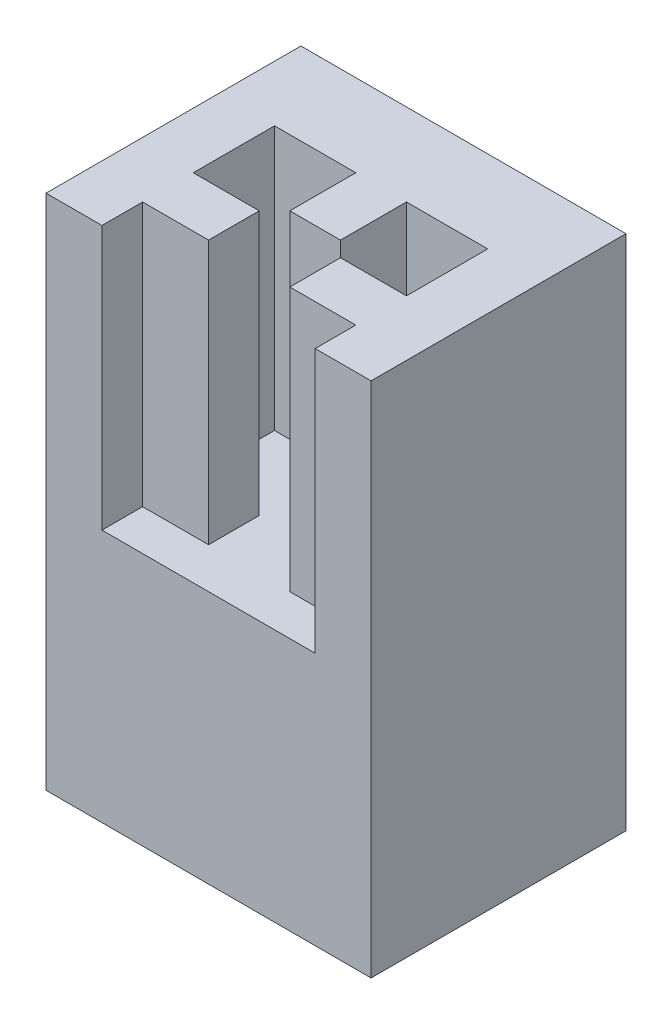
from build123d import *

# Parameters (mm, degrees)
ESQUISSE1_W                  = 30.8
ESQUISSE1_H                  = 24.15
BOSS_EXTRU_1_DEPTH           = 49
ESQUISSE3_R                  = 2.75
ENL_V_MAT_EXTRU_3_DEPTH      = 22
ENL_V_MAT_EXTRU_4_DEPTH      = 67.174451426
ENL_V_MAT_EXTRU_4_DEPTH_BACK = 25


with BuildPart() as part:
    # Esquisse1 → Boss.-Extru.1 (new body)
    with BuildSketch(Plane(origin=(0, 0, 0), x_dir=(1, 0, 0), z_dir=(0, 1, 0))):
        with Locations((-24.160479042, -8.248053892)):
            Rectangle(ESQUISSE1_W, ESQUISSE1_H)
    extrude(amount=BOSS_EXTRU_1_DEPTH)

    # Esquisse3 → Enlèv. mat.-Extru.3 (cut)
    with BuildSketch(Plane(origin=(0, 0, 0), x_dir=(-1, 0, 0), z_dir=(0, -1, 0))):
        with Locations(Location((24.160479042, -8.323053892, 0), (0, 0, 90))):
            Circle(ESQUISSE3_R)
    extrude(amount=-ENL_V_MAT_EXTRU_3_DEPTH, mode=Mode.SUBTRACT)

    # Esquisse2 → Enlèv. mat.-Extru.4 (cut, two sides: drawn at the far end of the back side and taken through both)
    with BuildSketch(Plane(origin=(0, 49, 0), x_dir=(1, 0, 0), z_dir=(0, 1, 0)).offset(-ENL_V_MAT_EXTRU_4_DEPTH_BACK)):
        Polygon((-34.260479042, -100.564708201), (-34.260479042, -20.323053892), (-34.260479042, -16.473053892), (-28.010479042, -16.473053892), (-28.010479042, -11.673053892), (-34.260479042, -11.673053892), (-34.260479042, -3.973053892), (-26.560479042, -3.973053892), (-26.560479042, -10.223053892), (-21.760479042, -10.223053892), (-21.760479042, -3.973053892), (-14.060479042, -3.973053892), (-14.060479042, -11.673053892), (-20.310479042, -11.673053892), (-20.310479042, -16.473053892), (-14.060479042, -16.473053892), (-14.060479042, -20.323053892), (-14.060479042, -100.564708201), (-14.060479042, -261.048016818), (-34.260479042, -261.048016818), align=None)
    extrude(amount=ENL_V_MAT_EXTRU_4_DEPTH + ENL_V_MAT_EXTRU_4_DEPTH_BACK, mode=Mode.SUBTRACT)


solid = part.part
